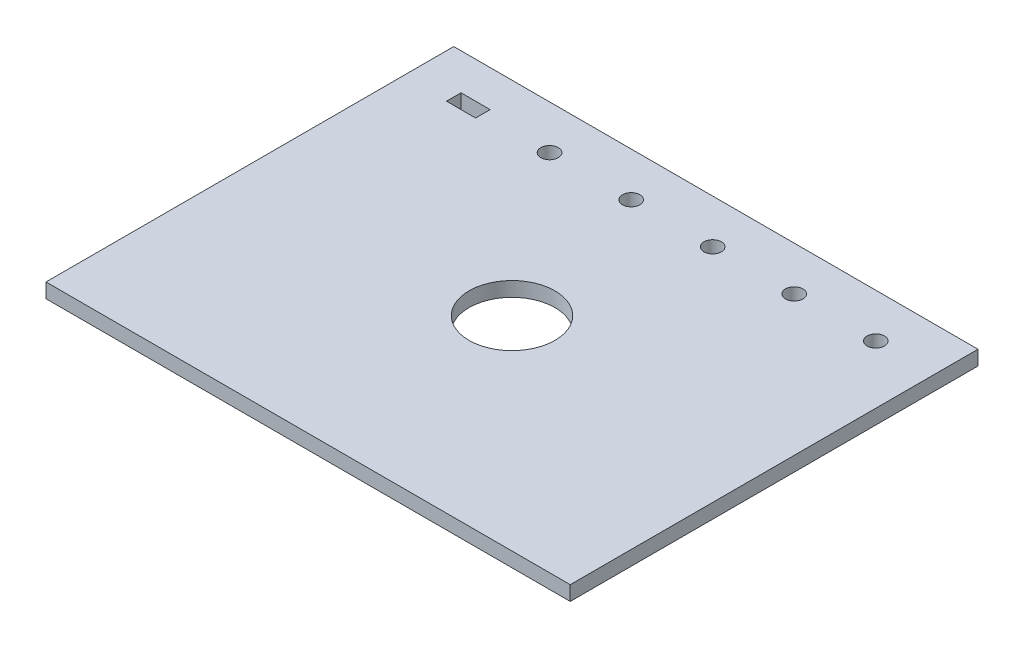
from build123d import *

# Parameters (mm, degrees)
IZIM1_W                     = 180
IZIM1_H                     = 140
IZIM1_R                     = 14.75
IZIM1_R_2                   = 3
IZIM1_W_2                   = 10
IZIM1_H_2                   = 5
Y_KSEKLIK_EKSTR_ZYON1_DEPTH = 5


with BuildPart() as part:
    # Çizim1 → Yükseklik-Ekstrüzyon1 (new body)
    with BuildSketch(Plane(origin=(0, 0, 0), x_dir=(1, 0, 0), z_dir=(0, 1, 0))):
        Rectangle(IZIM1_W, IZIM1_H)
        with Locations(Location((0, 0, 0), (0, 0, 270))):
            Circle(IZIM1_R, mode=Mode.SUBTRACT)
        with Locations(Location((70, 54.895079595, 0), (0, 0, 270))):
            Circle(IZIM1_R_2, mode=Mode.SUBTRACT)
        with Locations(Location((42, 54.895079595, 0), (0, 0, 270))):
            Circle(IZIM1_R_2, mode=Mode.SUBTRACT)
        with Locations(Location((14, 54.895079595, 0), (0, 0, 270))):
            Circle(IZIM1_R_2, mode=Mode.SUBTRACT)
        with Locations(Location((-14, 54.895079595, 0), (0, 0, 270))):
            Circle(IZIM1_R_2, mode=Mode.SUBTRACT)
        with Locations(Location((-42, 54.895079595, 0), (0, 0, 270))):
            Circle(IZIM1_R_2, mode=Mode.SUBTRACT)
        with Locations((-70, 55)):
            Rectangle(IZIM1_W_2, IZIM1_H_2, mode=Mode.SUBTRACT)
    extrude(amount=Y_KSEKLIK_EKSTR_ZYON1_DEPTH)


solid = part.part
